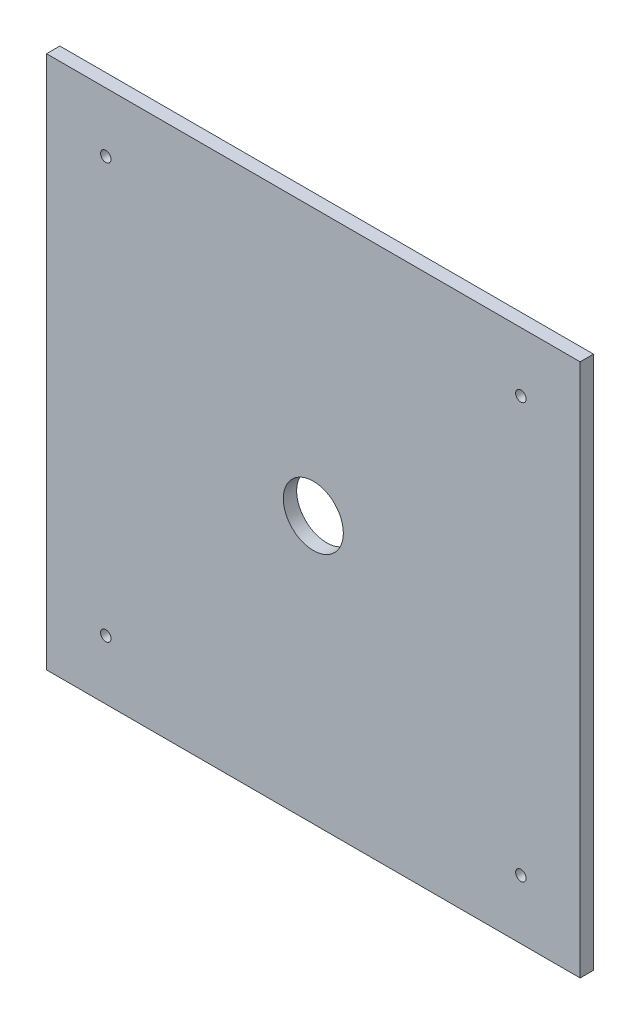
from build123d import *

# Parameters (mm, degrees)
SKETCH1_W                      = 254
SKETCH1_H                      = 254
SKETCH1_R                      = 10.16
SKETCH1_R_2                    = 14.2875
BOSS_EXTRUDE2_DEPTH            = 6.35
F_9_0_196_DIAMETER_HOLE1_D     = 4.9784
F_9_0_196_DIAMETER_HOLE1_DEPTH = 6.35
F_9_0_196_DIAMETER_HOLE1_TIP   = 1.495662253


with BuildPart() as part:
    # Sketch1 → Boss-Extrude2 (new body)
    # profile 1 of 4: a face of its own
    with BuildSketch(Plane.XY):
        Rectangle(SKETCH1_W, SKETCH1_H)
        with Locations((-41.221968309, 29.688201844)):
            Circle(SKETCH1_R, mode=Mode.SUBTRACT)
        with Locations((0, 49.5808)):
            Circle(SKETCH1_R_2, mode=Mode.SUBTRACT)
        Circle(SKETCH1_R_2, mode=Mode.SUBTRACT)
        with Locations((41.221968309, 29.688201844)):
            Circle(SKETCH1_R, mode=Mode.SUBTRACT)
    # profile 2 of 4: a face of its own
    with BuildSketch(Plane.XY):
        with Locations((0, 49.5808)):
            Circle(SKETCH1_R_2)
    # profile 3 of 4: a face of its own
    with BuildSketch(Plane.XY):
        with Locations((41.221968309, 29.688201844)):
            Circle(SKETCH1_R)
    # profile 4 of 4: a face of its own
    with BuildSketch(Plane.XY):
        with Locations((-41.221968309, 29.688201844)):
            Circle(SKETCH1_R)
    extrude(amount=BOSS_EXTRUDE2_DEPTH)

    # #9 (0.196) Diameter Hole1
    with Locations(Plane(origin=(0, 0, 0), x_dir=(-1, 0, 0), z_dir=(0, 0, -1))):
        with Locations((-98.782817332, 98.782817332), (98.782817332, 98.782817332), (98.782817332, -98.782817332), (-98.782817332, -98.782817332)):
            Hole(F_9_0_196_DIAMETER_HOLE1_D / 2, depth=F_9_0_196_DIAMETER_HOLE1_DEPTH)
            with Locations((0, 0, -(F_9_0_196_DIAMETER_HOLE1_DEPTH + F_9_0_196_DIAMETER_HOLE1_TIP / 2))):  # 118° drill point
                Cone(0, F_9_0_196_DIAMETER_HOLE1_D / 2, F_9_0_196_DIAMETER_HOLE1_TIP, mode=Mode.SUBTRACT)


solid = part.part
